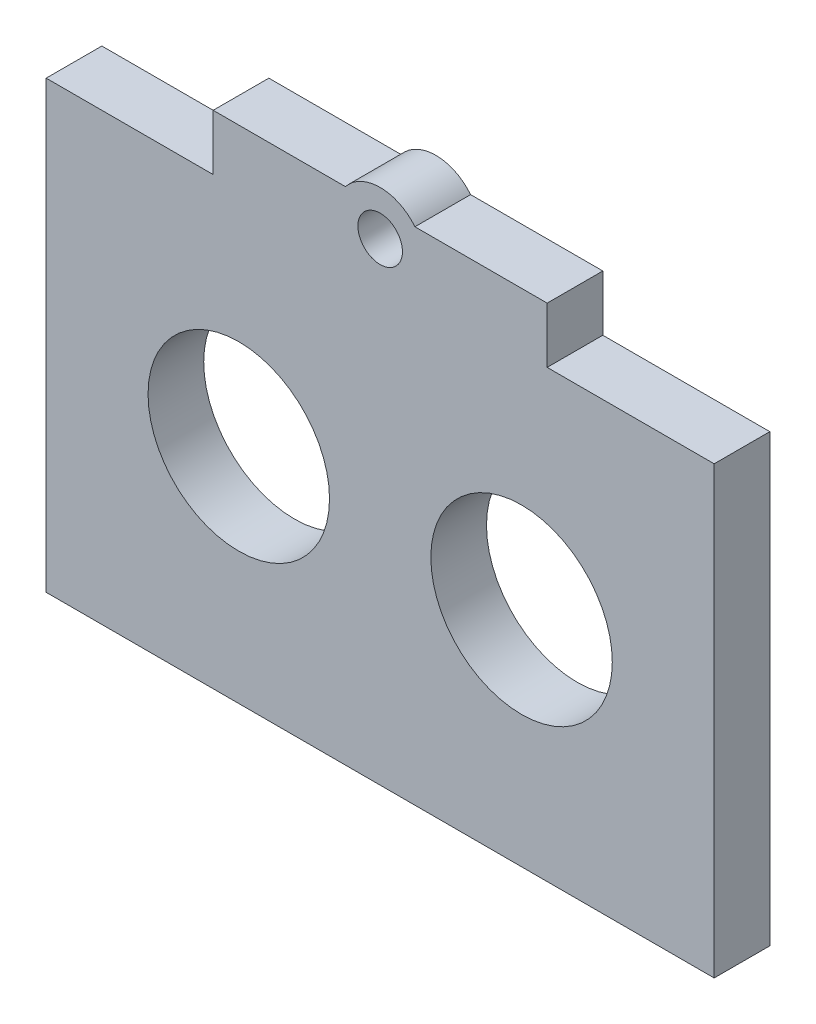
from build123d import *

# Parameters (mm, degrees)
ESQUISSE1_R        = 8.15
ESQUISSE1_R_2      = 2
BOSS_EXTRU_1_DEPTH = 5


with BuildPart() as part:
    # Esquisse1 → Boss.-Extru.1 (new body)
    # profile 1 of 7: a face of its own
    with BuildSketch(Plane.XY):
        Polygon((-30, 20), (-30, -20), (30, -20), (30, 20), (15, 20), (15, 15), (-15, 15), (-15, 20), align=None)
        with Locations((-12.7, 0)):
            Circle(ESQUISSE1_R, mode=Mode.SUBTRACT)
        with Locations((12.7, 0)):
            Circle(ESQUISSE1_R, mode=Mode.SUBTRACT)
    # profile 2 of 7: a face of its own
    with BuildSketch(Plane.XY):
        with BuildLine():
            Line((-3.122498999, 20), (-15, 20))
            Line((-15, 20), (-15, 15))
            Line((-15, 15), (15, 15))
            Line((15, 15), (15, 20))
            Line((15, 20), (3.122498999, 20))
            ThreePointArc((3.122498999, 20), (0, 18.5), (-3.122498999, 20))
        make_face()
    # profile 3 of 7: a face of its own
    with BuildSketch(Plane.XY):
        with BuildLine():
            Line((-15, 25), (-15, 20))
            Line((-15, 20), (-3.122498999, 20))
            ThreePointArc((-3.122498999, 20), (-4, 22.5), (-3.122498999, 25))
            Line((-3.122498999, 25), (-15, 25))
        make_face()
    # profile 4 of 7: a face of its own
    with BuildSketch(Plane.XY):
        with BuildLine():
            Line((3.122498999, 20), (15, 20))
            Line((15, 20), (15, 25))
            Line((15, 25), (3.122498999, 25))
            ThreePointArc((3.122498999, 25), (3.774254628, 23.824764885), (4, 22.5))
            ThreePointArc((4, 22.5), (3.774254628, 21.175235115), (3.122498999, 20))
        make_face()
    # profile 5 of 7: a face of its own
    with BuildSketch(Plane.XY):
        with BuildLine():
            Line((3.122498999, 20), (-3.122498999, 20))
            ThreePointArc((-3.122498999, 20), (0, 18.5), (3.122498999, 20))
        make_face()
    # profile 6 of 7: a face of its own
    with BuildSketch(Plane.XY):
        with BuildLine():
            ThreePointArc((-3.122498999, 25), (-4, 22.5), (-3.122498999, 20))
            Line((-3.122498999, 20), (3.122498999, 20))
            ThreePointArc((3.122498999, 20), (3.774254628, 21.175235115), (4, 22.5))
            ThreePointArc((4, 22.5), (3.774254628, 23.824764885), (3.122498999, 25))
            Line((3.122498999, 25), (-3.122498999, 25))
        make_face()
        with Locations((0, 22.5)):
            Circle(ESQUISSE1_R_2, mode=Mode.SUBTRACT)
    # profile 7 of 7: a face of its own
    with BuildSketch(Plane.XY):
        with BuildLine():
            ThreePointArc((3.122498999, 25), (0, 26.5), (-3.122498999, 25))
            Line((-3.122498999, 25), (3.122498999, 25))
        make_face()
    extrude(amount=BOSS_EXTRU_1_DEPTH)


solid = part.part
